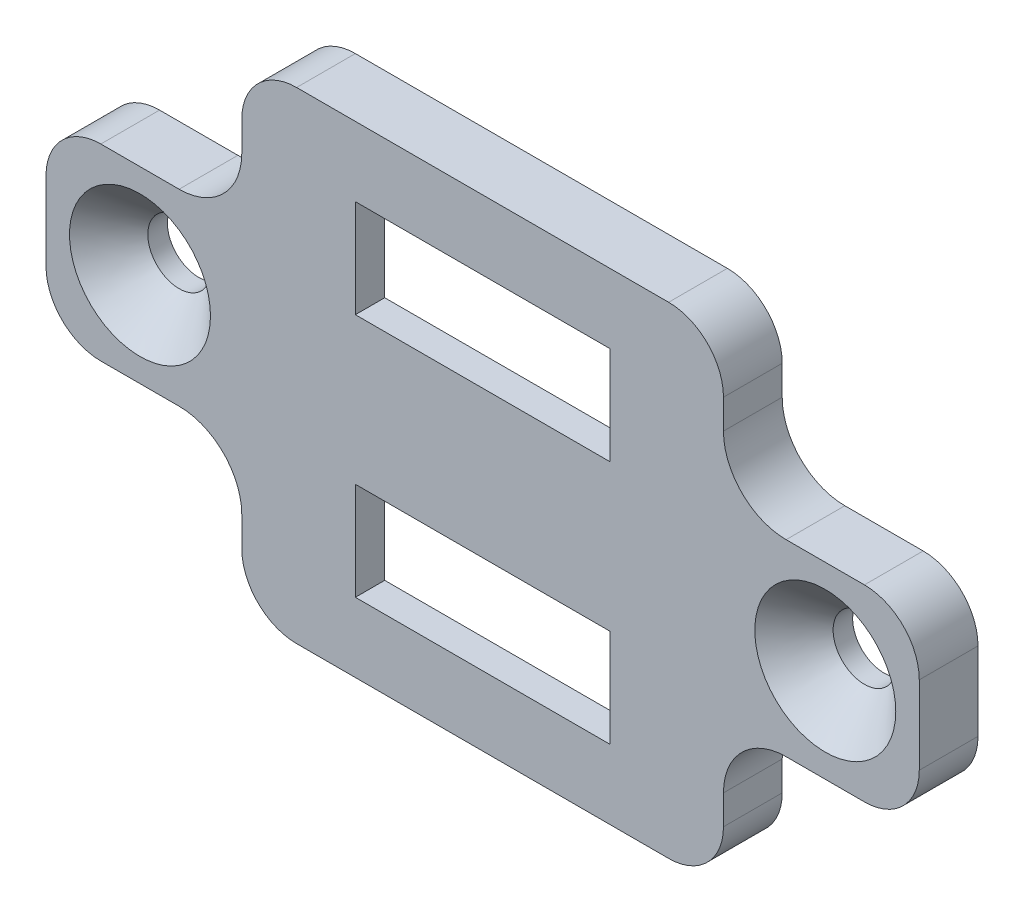
from build123d import *

# Parameters (mm, degrees)
ESQUISSE1_R             = 1.6
BOSS_EXTRU_1_DEPTH      = 3
ENL_V_MAT_EXTRU_1_DEPTH = 1.5
ESQUISSE4_W             = 13
ESQUISSE4_H             = 5
ENL_V_MAT_EXTRU_2_DEPTH = 26.511370014
CHANFREIN1_SIZE         = 2


with BuildPart() as part:
    # Esquisse1 → Boss.-Extru.1 (new body)
    with BuildSketch(Plane.XY):
        with BuildLine():
            Line((-9.5, 12.3), (9.5, 12.3))
            ThreePointArc((9.5, 12.3), (11.479898987, 11.479898987), (12.3, 9.5))
            Line((12.3, 9.5), (12.3, 8))
            ThreePointArc((12.3, 8), (13.2372583, 5.7372583), (15.5, 4.8))
            Line((15.5, 4.8), (19.5, 4.8))
            ThreePointArc((19.5, 4.8), (21.479898987, 3.979898987), (22.3, 2))
            Line((22.3, 2), (22.3, -2))
            ThreePointArc((22.3, -2), (21.479898987, -3.979898987), (19.5, -4.8))
            Line((19.5, -4.8), (15.5, -4.8))
            ThreePointArc((15.5, -4.8), (13.2372583, -5.7372583), (12.3, -8))
            Line((12.3, -8), (12.3, -9.5))
            ThreePointArc((12.3, -9.5), (11.479898987, -11.479898987), (9.5, -12.3))
            Line((9.5, -12.3), (-9.5, -12.3))
            ThreePointArc((-9.5, -12.3), (-11.479898987, -11.479898987), (-12.3, -9.5))
            Line((-12.3, -9.5), (-12.3, -8))
            ThreePointArc((-12.3, -8), (-13.2372583, -5.7372583), (-15.5, -4.8))
            Line((-15.5, -4.8), (-19.5, -4.8))
            ThreePointArc((-19.5, -4.8), (-21.479898987, -3.979898987), (-22.3, -2))
            Line((-22.3, -2), (-22.3, 2))
            ThreePointArc((-22.3, 2), (-21.479898987, 3.979898987), (-19.5, 4.8))
            Line((-19.5, 4.8), (-15.5, 4.8))
            ThreePointArc((-15.5, 4.8), (-13.2372583, 5.7372583), (-12.3, 8))
            Line((-12.3, 8), (-12.3, 9.5))
            ThreePointArc((-12.3, 9.5), (-11.479898987, 11.479898987), (-9.5, 12.3))
        make_face()
        with Locations((-17.5, 0)):
            Circle(ESQUISSE1_R, mode=Mode.SUBTRACT)
        with Locations((17.5, 0)):
            Circle(ESQUISSE1_R, mode=Mode.SUBTRACT)
    extrude(amount=BOSS_EXTRU_1_DEPTH)

    # Esquisse2 → Enlèv. mat.-Extru.1 (cut)
    with BuildSketch(Plane(origin=(0, 0, 0), x_dir=(-1, 0, 0), z_dir=(0, 0, -1))):
        with BuildLine():
            Line((-8.75, 11.75), (8.75, 11.75))
            ThreePointArc((8.75, 11.75), (10.871320344, 10.871320344), (11.75, 8.75))
            Line((11.75, 8.75), (11.75, -8.75))
            ThreePointArc((11.75, -8.75), (10.871320344, -10.871320344), (8.75, -11.75))
            Line((8.75, -11.75), (-8.75, -11.75))
            ThreePointArc((-8.75, -11.75), (-10.871320344, -10.871320344), (-11.75, -8.75))
            Line((-11.75, -8.75), (-11.75, 8.75))
            ThreePointArc((-11.75, 8.75), (-10.871320344, 10.871320344), (-8.75, 11.75))
        make_face()
    extrude(amount=-ENL_V_MAT_EXTRU_1_DEPTH, mode=Mode.SUBTRACT)

    # Esquisse4 → Enlèv. mat.-Extru.2 (cut, through all)
    with BuildSketch(Plane(origin=(0, 0, 1.5), x_dir=(-1, 0, 0), z_dir=(0, 0, -1))):
        with Locations((0, 6.25)):
            Rectangle(ESQUISSE4_W, ESQUISSE4_H)
        with Locations((0, -6.25)):
            Rectangle(ESQUISSE4_W, ESQUISSE4_H)
    extrude(amount=-ENL_V_MAT_EXTRU_2_DEPTH, mode=Mode.SUBTRACT)

    # Chanfrein1
    chanfrein1_edges = [part.edges().sort_by_distance(p)[0] for p in [
        (-19.1, 0, 3),
        (15.9, 0, 3),
    ]]
    chamfer(chanfrein1_edges, length=CHANFREIN1_SIZE)


solid = part.part
